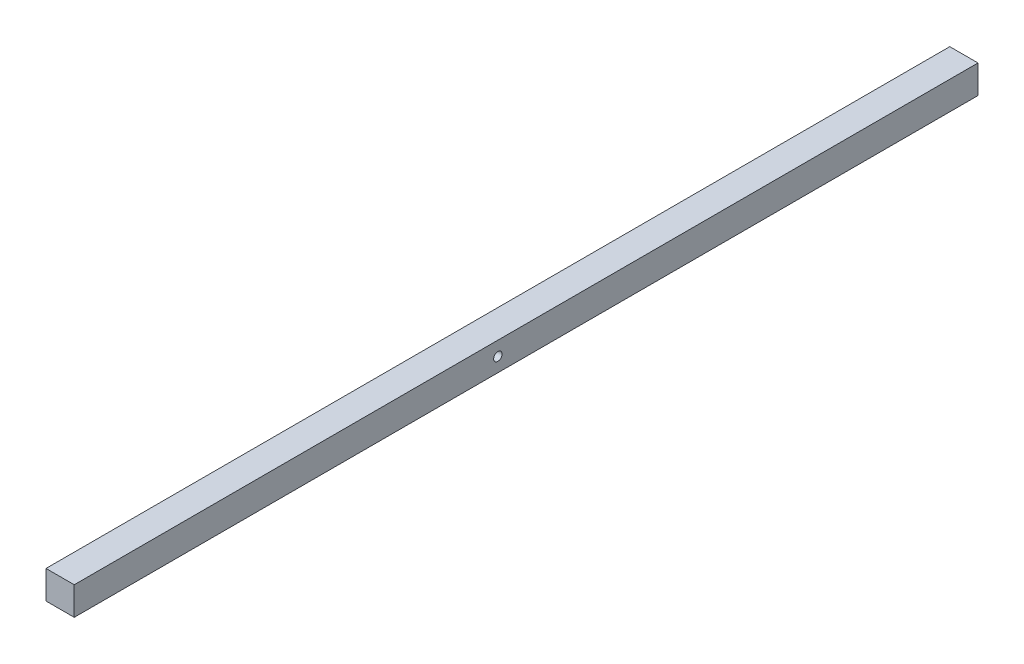
from build123d import *

# Parameters (mm, degrees)
SZKIC1_W                    = 20
SZKIC1_H                    = 20
DODANIE_WYCI_GNI_CIE1_DEPTH = 640
SZKIC2_R                    = 3
WYTNIJ_WYCI_GNI_CIE1_DEPTH  = 8


with BuildPart() as part:
    # Szkic1 → Dodanie-wyciągnięcie1 (new body)
    with BuildSketch(Plane.XY):
        with Locations((10, 10)):
            Rectangle(SZKIC1_W, SZKIC1_H)
    extrude(amount=DODANIE_WYCI_GNI_CIE1_DEPTH)

    # Szkic2 → Wytnij-wyciągnięcie1 (cut)
    with BuildSketch(Plane(origin=(20, 0, 0), x_dir=(0, 0, -1), z_dir=(1, 0, 0))):
        with Locations((-340, 10)):
            Circle(SZKIC2_R)
    extrude(amount=-WYTNIJ_WYCI_GNI_CIE1_DEPTH, mode=Mode.SUBTRACT)


solid = part.part
